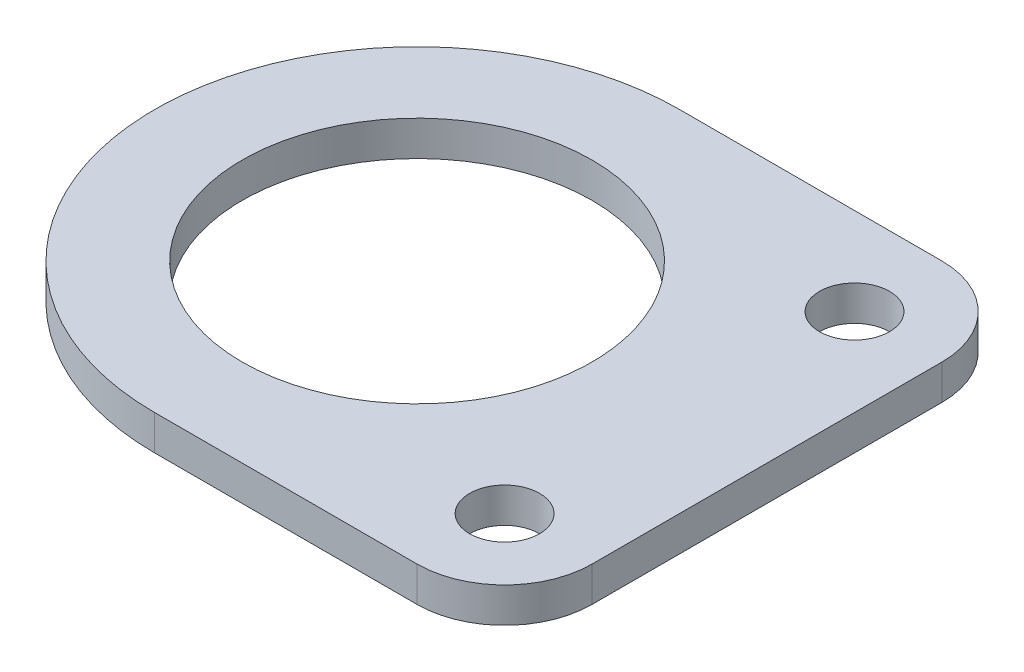
from build123d import *

# Parameters (mm, degrees)
BOSS_EXTRUDE1_START = -2
BOSS_EXTRUDE1_DEPTH = 2
SKETCH4_R           = 2
CUT_EXTRUDE1_DEPTH  = 2
SKETCH6_R           = 11
CUT_EXTRUDE2_DEPTH  = 1


with BuildPart() as part:
    # Sketch2 → Revolve1 (revolve)
    with BuildSketch(Plane.XY, mode=Mode.PRIVATE) as revolve1_sk:
        Polygon((-10, 3), (-10, 2), (-10, 0), (-15, 0), (-15, 2), (-11, 2), (-11, 3), align=None)
    revolve(revolve1_sk.sketch.rotate(Axis((0, 45.867309825, 0), (0, -1, 0)), 270), axis=Axis((0, 45.867309825, 0), (0, -1, 0)))

    # Sketch3 → Boss-Extrude1 (add)
    with BuildSketch(Plane.XZ.offset(BOSS_EXTRUDE1_START)):
        with BuildLine():
            Line((0, -15), (15, -15))
            ThreePointArc((15, -15), (18.535533906, -13.535533906), (20, -10))
            Line((20, -10), (20, 10))
            ThreePointArc((20, 10), (18.535533906, 13.535533906), (15, 15))
            Line((15, 15), (0, 15))
            ThreePointArc((0, 15), (15, 0), (0, -15))
        make_face()
    extrude(amount=BOSS_EXTRUDE1_DEPTH)

    # Sketch4 → Cut-Extrude1 (cut)
    with BuildSketch(Plane.XZ):
        with Locations(Location((15, 10, 0), (0, 0, 270))):
            Circle(SKETCH4_R)
        with Locations(Location((15, -10, 0), (0, 0, 270))):
            Circle(SKETCH4_R)
    extrude(amount=-CUT_EXTRUDE1_DEPTH, mode=Mode.SUBTRACT)

    # Sketch6 → Cut-Extrude2 (cut)
    with BuildSketch(Plane(origin=(0, 3, 0), x_dir=(1, 0, 0), z_dir=(0, 1, 0))):
        Circle(SKETCH6_R)
    extrude(amount=-CUT_EXTRUDE2_DEPTH, mode=Mode.SUBTRACT)


solid = part.part
